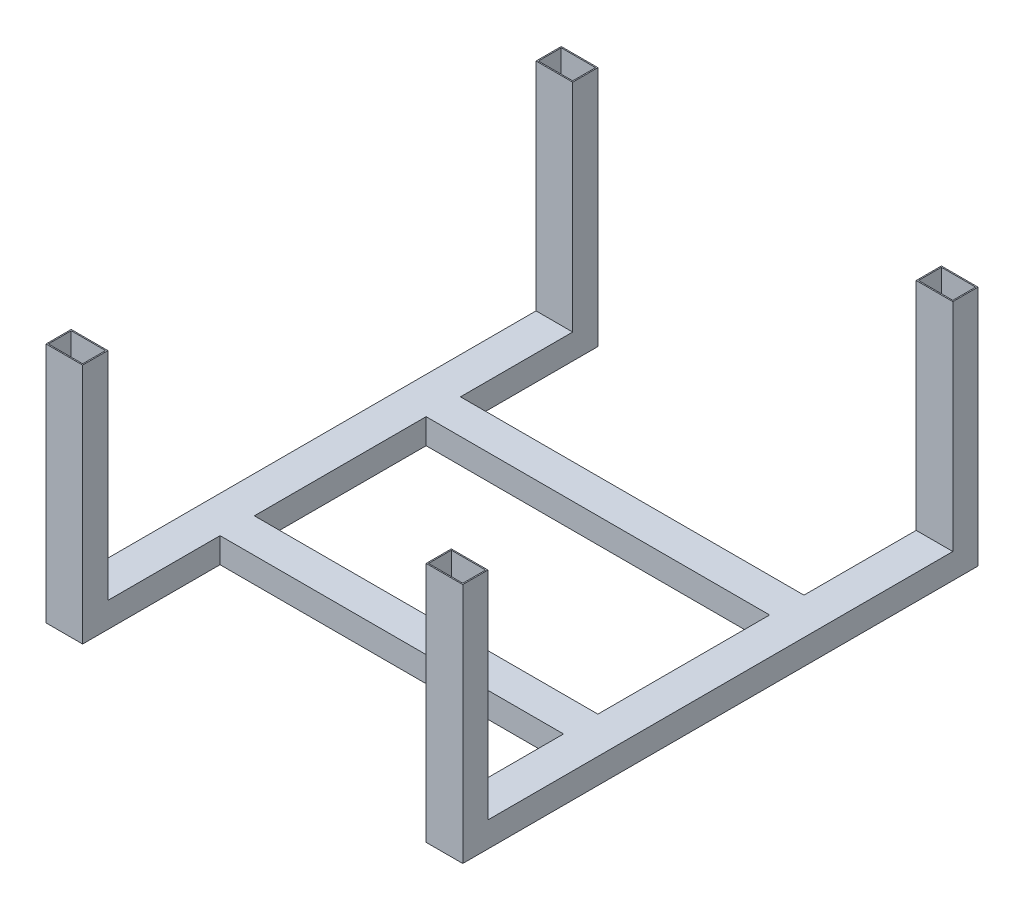
from build123d import *

# Parameters (mm, degrees)
SKETCH1_W           = 32
SKETCH1_H           = 22
SKETCH1_W_2         = 30
SKETCH1_H_2         = 20
SKETCH3_W           = 30
SKETCH3_H           = 22
SKETCH3_W_2         = 28
SKETCH3_H_2         = 20
EXTRUDE_THIN1_DEPTH = 150


with BuildPart() as part:
    # Sweep-Thin1: sweep along a path in Sketch2
    with BuildLine(Plane(origin=(0, 0, 0), x_dir=(0, 0, -1), z_dir=(1, 0, 0))) as sweep_thin1_path:
        Line((0, 0), (0, -200))
        Line((0, -200), (428, -200))
        Line((428, -200), (428, 0))
    # Sketch1 → Sweep-Thin1 (sweep)
    with BuildSketch(Plane(origin=(0, 0, 0), x_dir=(1, 0, 0), z_dir=(0, 1, 0))):
        Rectangle(SKETCH1_W, SKETCH1_H)
        Rectangle(SKETCH1_W_2, SKETCH1_H_2, mode=Mode.SUBTRACT)
    sweep_thin1 = sweep(path=sweep_thin1_path.line, transition=Transition.RIGHT)

    # Sketch3 → Extrude-Thin1 (add)
    # profile 1 of 2: a face of its own
    with BuildSketch(Plane(origin=(16, 0, 0), x_dir=(0, 0, -1), z_dir=(1, 0, 0))):
        with Locations((124, -200)):
            Rectangle(SKETCH3_W, SKETCH3_H)
        with Locations((124, -200)):
            Rectangle(SKETCH3_W_2, SKETCH3_H_2, mode=Mode.SUBTRACT)
    # profile 2 of 2: a face of its own
    with BuildSketch(Plane(origin=(16, 0, 0), x_dir=(0, 0, -1), z_dir=(1, 0, 0))):
        with Locations((304, -200)):
            Rectangle(SKETCH3_W, SKETCH3_H)
        with Locations((304, -200)):
            Rectangle(SKETCH3_W_2, SKETCH3_H_2, mode=Mode.SUBTRACT)
    extrude_thin1 = extrude(amount=EXTRUDE_THIN1_DEPTH)

    # Mirror9: Extrude-Thin1 across plane
    add(extrude_thin1.mirror(Plane(origin=(166, 0, 0), x_dir=(0, 0, 1), z_dir=(1, 0, 0))))

    # Mirror10: Sweep-Thin1 across plane
    add(sweep_thin1.mirror(Plane(origin=(166, 0, 0), x_dir=(0, 0, 1), z_dir=(1, 0, 0))))


solid = part.part
